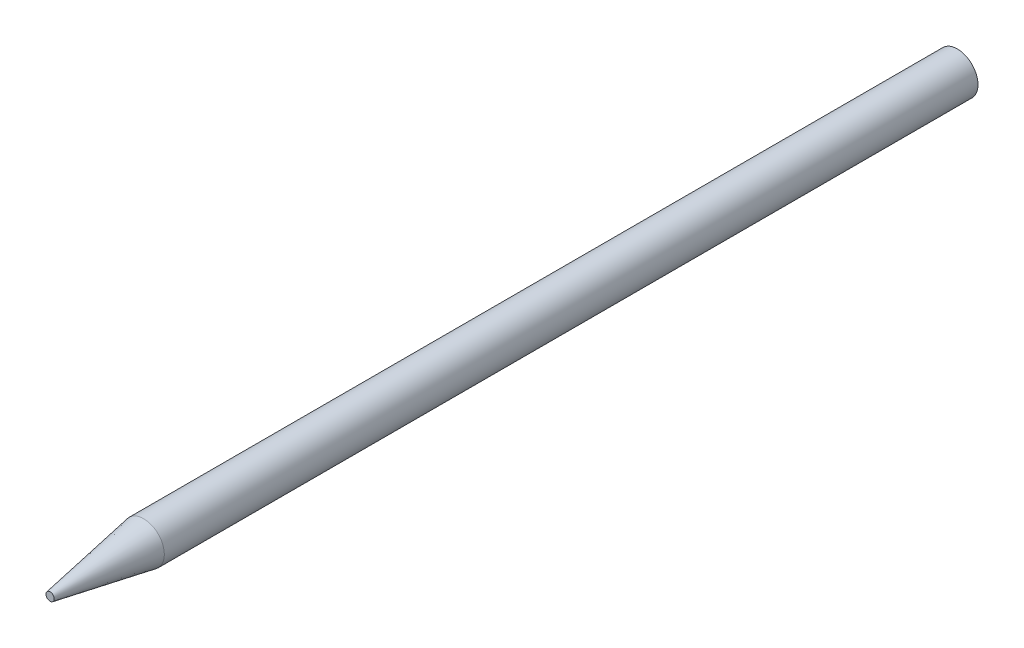
from build123d import *

# Parameters (mm, degrees)
SKETCH1_R           = 2.5
BOSS_EXTRUDE1_DEPTH = 110
CHAMFER1_SIZE       = 2
CHAMFER1_SIZE2      = 11.342563639


with BuildPart() as part:
    # Sketch1 → Boss-Extrude1 (new body)
    with BuildSketch(Plane.XY):
        Circle(SKETCH1_R)
    extrude(amount=BOSS_EXTRUDE1_DEPTH)

    # Chamfer1
    chamfer1_edges = [part.edges().sort_by_distance(p)[0] for p in [
        (-2.5, 0, 110),
    ]]
    chamfer1_side = [part.faces().sort_by_distance(p)[0] for p in [
        (0, 0, 110),
    ]]
    chamfer(chamfer1_edges, length=CHAMFER1_SIZE, length2=CHAMFER1_SIZE2, reference=chamfer1_side[0])


solid = part.part
